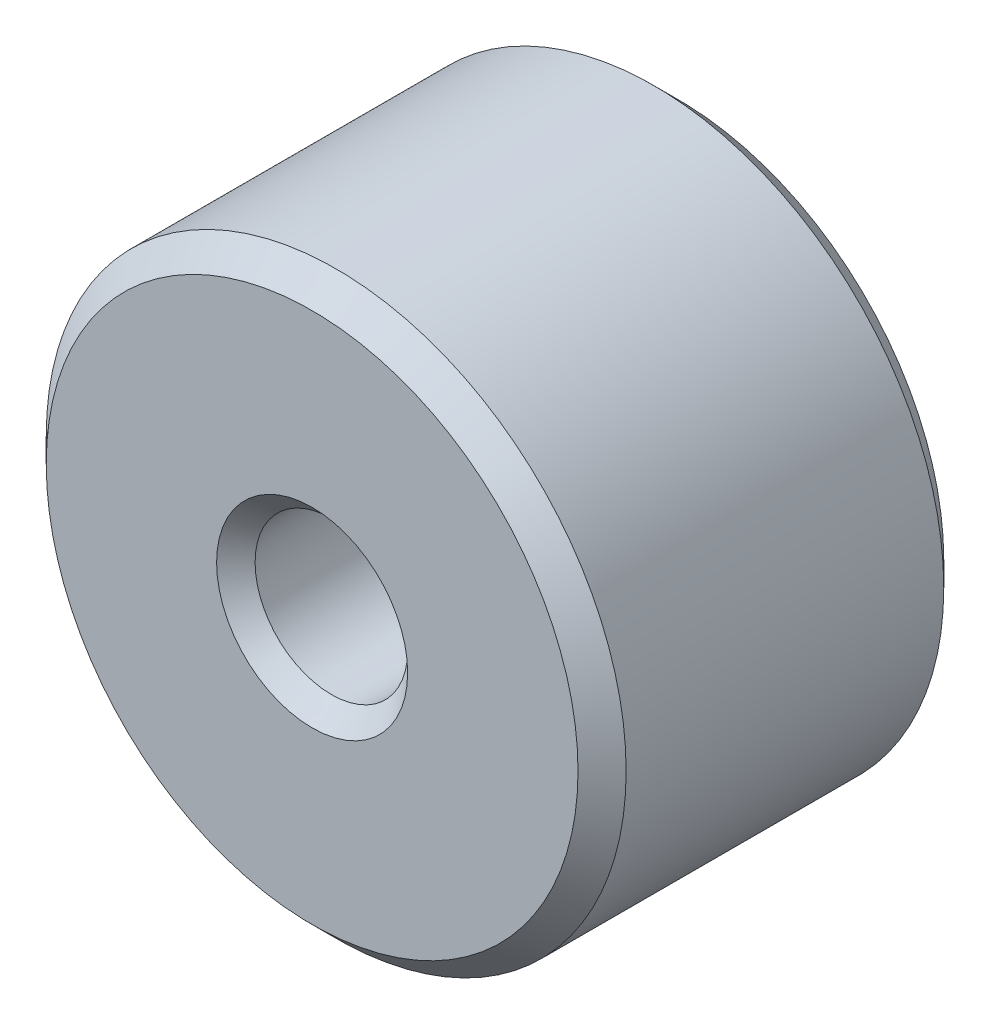
from build123d import *

# Parameters (mm, degrees)
SKETCH1_R           = 6.025
SKETCH1_R_2         = 1.585
BOSS_EXTRUDE1_DEPTH = 7.6
CHAMFER1_SIZE       = 0.5
CHAFL_N1_SIZE       = 0.4
CHAFL_N2_SIZE       = 1


with BuildPart() as part:
    # Sketch1 → Boss-Extrude1 (new body)
    with BuildSketch(Plane.XY):
        with Locations(Location((0, 0, 0), (0, 0, 180))):
            Circle(SKETCH1_R)
        with Locations(Location((0, 0, 0), (0, 0, 180))):
            Circle(SKETCH1_R_2, mode=Mode.SUBTRACT)
    extrude(amount=BOSS_EXTRUDE1_DEPTH)

    # Chamfer1
    chamfer1_edges = [part.edges().sort_by_distance(p)[0] for p in [
        (6.025, 0, 0),
        (6.025, 0, 7.6),
    ]]
    chamfer(chamfer1_edges, length=CHAMFER1_SIZE)

    # Chaflán1
    chafl_n1_edges = [part.edges().sort_by_distance(p)[0] for p in [
        (1.585, 0, 7.6),
    ]]
    chamfer(chafl_n1_edges, length=CHAFL_N1_SIZE)

    # Chaflán2
    chafl_n2_edges = [part.edges().sort_by_distance(p)[0] for p in [
        (1.585, 0, 0),
    ]]
    chamfer(chafl_n2_edges, length=CHAFL_N2_SIZE)


solid = part.part
